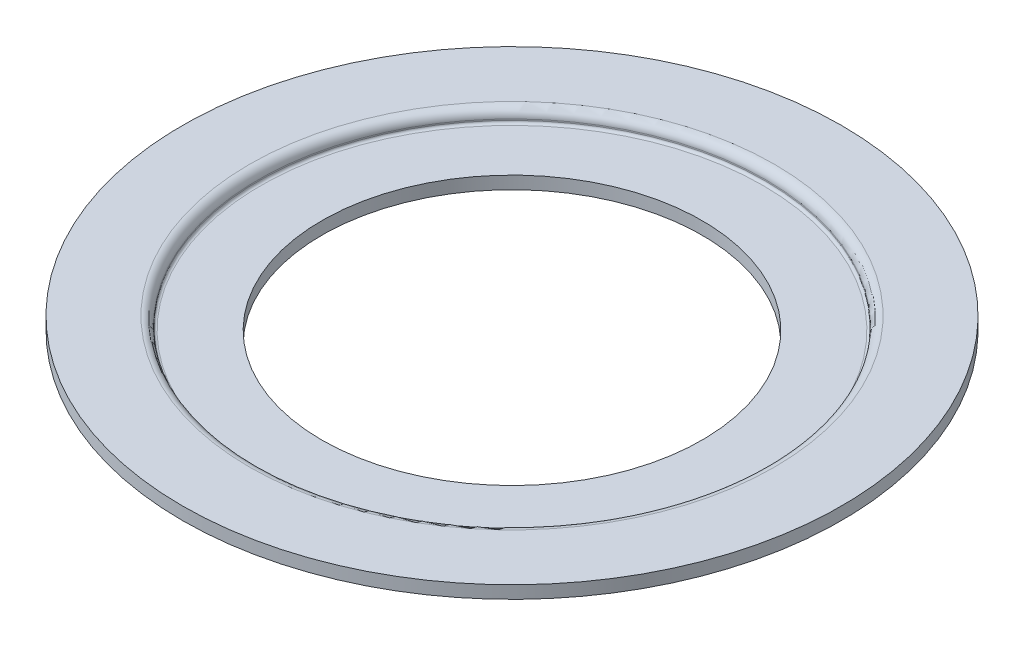
from build123d import *

# Parameters (mm, degrees)
CONG_1_R = 0.7
CONG_2_R = 0.2


with BuildPart() as part:
    # Esquisse1 → Base-Révol.-Mince (revolve)
    with BuildSketch(Plane.XY, mode=Mode.PRIVATE) as base_r_vol_mince_sk:
        Polygon((-26, 1), (-20, 1), (-20, 0), (-15, 0), (-15, -1), (-21, -1), (-21, 0), (-26, 0), align=None)
    revolve(base_r_vol_mince_sk.sketch.rotate(Axis((0, 0, 0), (0, -1, 0)), 90), axis=Axis((0, 0, 0), (0, -1, 0)))

    # Congé1
    cong_1_edges = [part.edges().sort_by_distance(p)[0] for p in [
        (0, 1, 20),
        (0, -1, 21),
    ]]
    fillet(cong_1_edges, radius=CONG_1_R)

    # Congé2
    cong_2_edges = [part.edges().sort_by_distance(p)[0] for p in [
        (0, 0, 20),
    ]]
    fillet(cong_2_edges, radius=CONG_2_R)


solid = part.part
